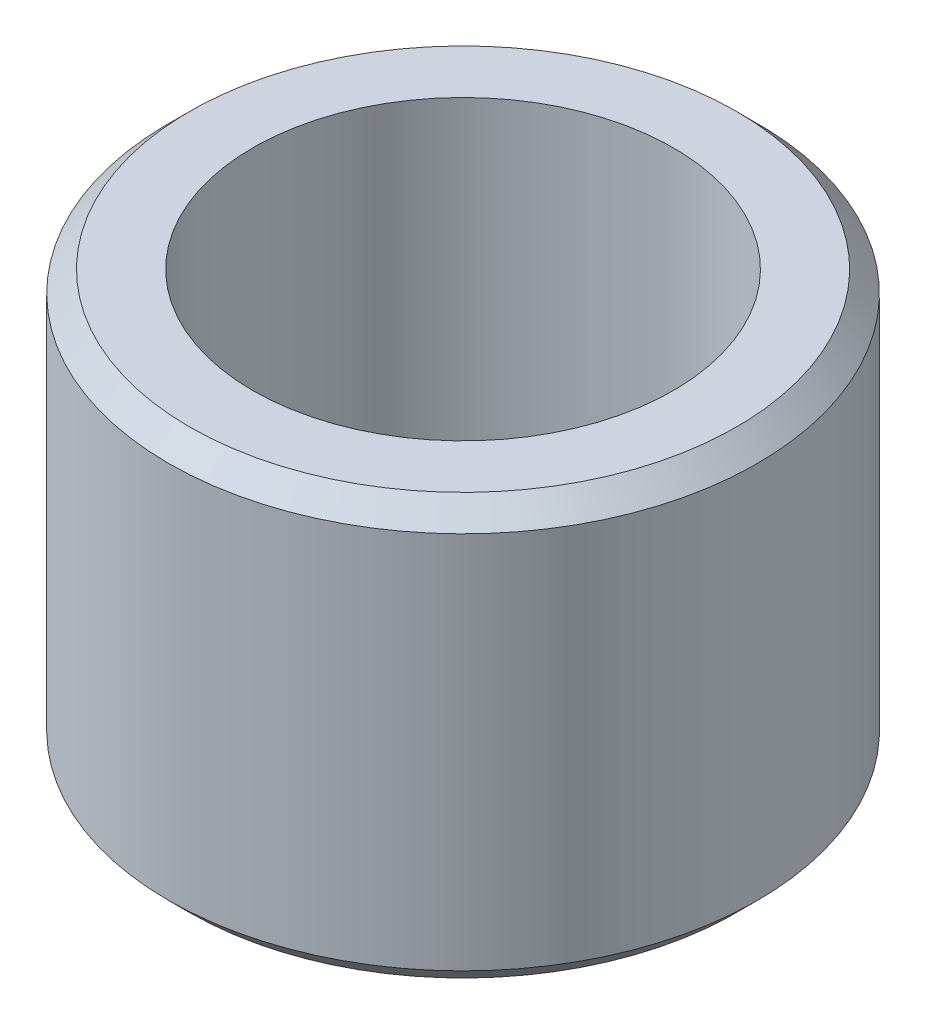
from build123d import *

# Parameters (mm, degrees)
SKETCH_1_R      = 7
SKETCH_1_R_2    = 5
EXTRUDE_1_DEPTH = 5
CHAMFER_1_SIZE  = 0.5


with BuildPart() as part:
    # 草图1 → 凸台-拉伸1 (new, symmetric)
    with BuildSketch(Plane(origin=(0, 0, 0), x_dir=(1, 0, 0), z_dir=(0, 1, 0))):
        with Locations(Location((0, 0, 0), (0, 0, 270))):
            Circle(SKETCH_1_R)
        with Locations(Location((0, 0, 0), (0, 0, 270))):
            Circle(SKETCH_1_R_2, mode=Mode.SUBTRACT)
    extrude(amount=EXTRUDE_1_DEPTH, both=True)

    # 倒角1
    chamfer_1_edges = [part.edges().sort_by_distance(p)[0] for p in [
        (0, -5, -7),
        (0, 5, -7),
    ]]
    chamfer(chamfer_1_edges, length=CHAMFER_1_SIZE)


solid = part.part
